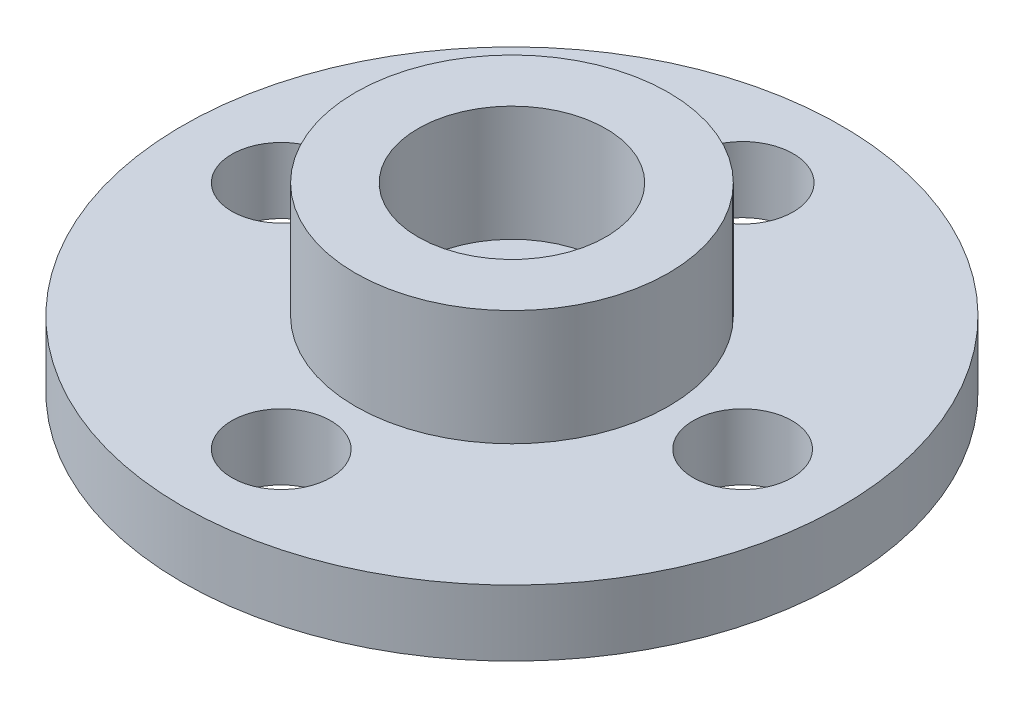
from build123d import *

# Parameters (mm, degrees)
CROQUIS1_R              = 10
CROQUIS1_R_2            = 1.5
CROQUIS1_R_3            = 1.533499393
CROQUIS1_R_4            = 2.75
SALIENTE_EXTRUIR1_DEPTH = 2
CROQUIS2_R              = 4.75
CROQUIS2_R_2            = 2.85
SALIENTE_EXTRUIR2_DEPTH = 3.5


with BuildPart() as part:
    # Croquis1 → Saliente-Extruir1 (new body)
    # profile 1 of 2: a face of its own
    with BuildSketch(Plane(origin=(0, 0, 0), x_dir=(1, 0, 0), z_dir=(0, 1, 0))):
        with Locations(Location((0, 0, 0), (0, 0, 270))):
            Circle(CROQUIS1_R)
        with Locations(Location((-7, 0, 0), (0, 0, 270))):
            Circle(CROQUIS1_R_2, mode=Mode.SUBTRACT)
        with Locations(Location((0, -7, 0), (0, 0, 270))):
            Circle(CROQUIS1_R_2, mode=Mode.SUBTRACT)
        with Locations(Location((7, 0, 0), (0, 0, 270))):
            Circle(CROQUIS1_R_2, mode=Mode.SUBTRACT)
        with Locations(Location((0, 7, 0), (0, 0, 270))):
            Circle(CROQUIS1_R_3, mode=Mode.SUBTRACT)
        Circle(CROQUIS1_R_4, mode=Mode.SUBTRACT)
    # profile 2 of 2: a face of its own
    with BuildSketch(Plane(origin=(0, 0, 0), x_dir=(1, 0, 0), z_dir=(0, 1, 0))):
        Circle(CROQUIS1_R_4)
        with Locations(Location((0, 0, 0), (0, 0, 270))):
            Circle(CROQUIS1_R_2, mode=Mode.SUBTRACT)
    extrude(amount=SALIENTE_EXTRUIR1_DEPTH)

    # Croquis2 → Saliente-Extruir2 (add)
    with BuildSketch(Plane(origin=(0, 2, 0), x_dir=(1, 0, 0), z_dir=(0, 1, 0))):
        with Locations(Location((0, 0, 0), (0, 0, 270))):
            Circle(CROQUIS2_R)
        with Locations(Location((0, 0, 0), (0, 0, 270))):
            Circle(CROQUIS2_R_2, mode=Mode.SUBTRACT)
    extrude(amount=SALIENTE_EXTRUIR2_DEPTH)


solid = part.part
